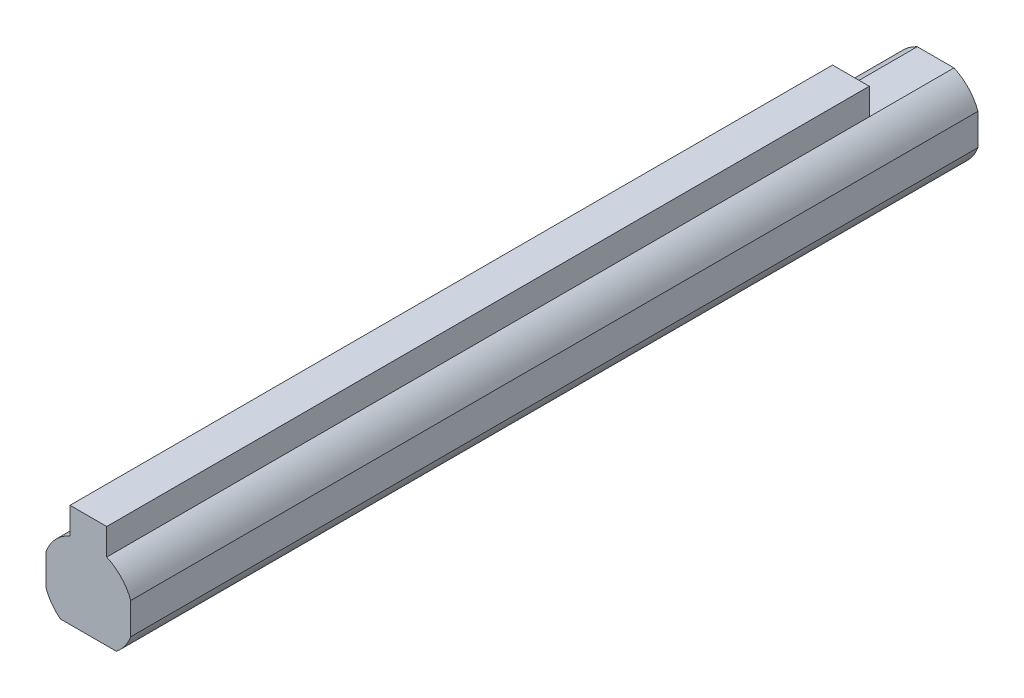
from build123d import *

# Parameters (mm, degrees)
BOSS_EXTRUDE1_DEPTH = 150
BOSS_EXTRUDE2_START = 150
SKETCH1_3_W         = 6.5
SKETCH1_3_H         = 4.689904241
BOSS_EXTRUDE2_DEPTH = 135


with BuildPart() as part:
    # Sketch1 → Boss-Extrude1 (new body)
    with BuildSketch(Plane.XY):
        with BuildLine():
            Line((3.25, 7.310095759), (-3.25, 7.310095759))
            ThreePointArc((-3.25, 7.310095759), (-5.832004573, 5.476104698), (-7.5, 2.783882181))
            Line((-7.5, 2.783882181), (-7.5, -2.783882181))
            ThreePointArc((-7.5, -2.783882181), (-6.466277075, -4.710335529), (-4.949623723, -6.285))
            Line((-4.949623723, -6.285), (4.949623723, -6.285))
            ThreePointArc((4.949623723, -6.285), (6.466277075, -4.710335529), (7.5, -2.783882181))
            Line((7.5, -2.783882181), (7.5, 2.783882181))
            ThreePointArc((7.5, 2.783882181), (5.832004573, 5.476104698), (3.25, 7.310095759))
        make_face()
    extrude(amount=BOSS_EXTRUDE1_DEPTH)

    # Sketch1<3> → Boss-Extrude2 (add)
    with BuildSketch(Plane.XY.offset(BOSS_EXTRUDE2_START)):
        with Locations((0, 9.655047879)):
            Rectangle(SKETCH1_3_W, SKETCH1_3_H)
    extrude(amount=-BOSS_EXTRUDE2_DEPTH)


solid = part.part
